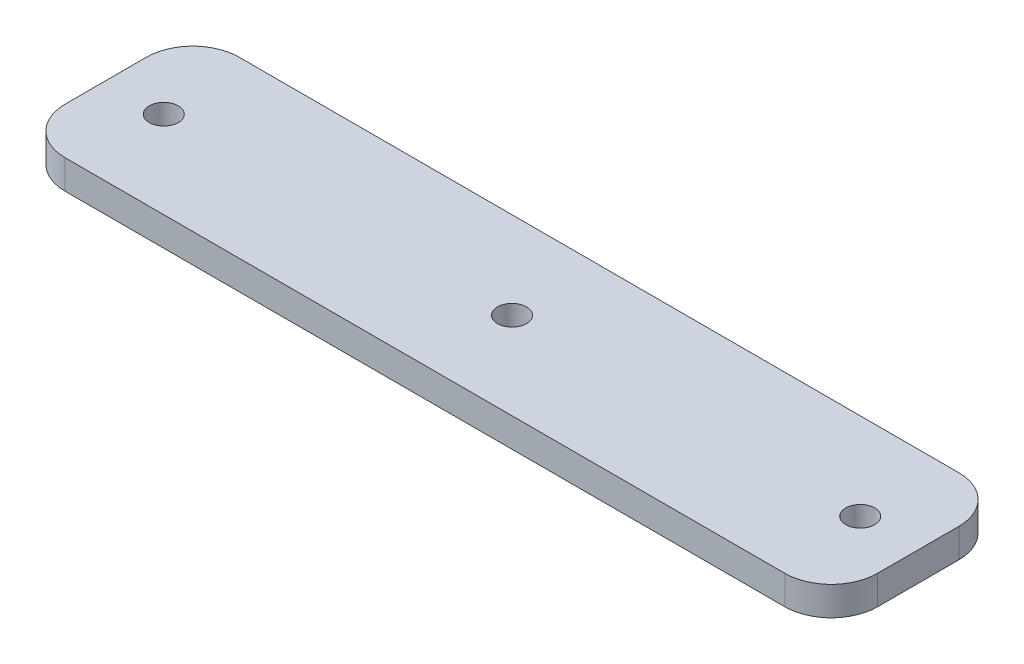
from build123d import *

# Parameters (mm, degrees)
SKETCH1_R           = 3.175
BOSS_EXTRUDE1_DEPTH = 6.35


with BuildPart() as part:
    # Sketch1 → Boss-Extrude1 (new body)
    with BuildSketch(Plane(origin=(0, 0, 0), x_dir=(1, 0, 0), z_dir=(0, 1, 0))):
        with BuildLine():
            Line((10.16, 0), (167.64, 0))
            ThreePointArc((167.64, 0), (174.824204897, -2.975795103), (177.8, -10.16))
            Line((177.8, -10.16), (177.8, -27.94))
            ThreePointArc((177.8, -27.94), (174.824204897, -35.124204897), (167.64, -38.1))
            Line((167.64, -38.1), (10.16, -38.1))
            ThreePointArc((10.16, -38.1), (2.975795103, -35.124204897), (0, -27.94))
            Line((0, -27.94), (0, -10.16))
            ThreePointArc((0, -10.16), (2.975795103, -2.975795103), (10.16, 0))
        make_face()
        with Locations(Location((12.7, -19.05, 0), (0, 0, 270))):
            Circle(SKETCH1_R, mode=Mode.SUBTRACT)
        with Locations(Location((88.9, -19.05, 0), (0, 0, 270))):
            Circle(SKETCH1_R, mode=Mode.SUBTRACT)
        with Locations(Location((165.1, -19.05, 0), (0, 0, 270))):
            Circle(SKETCH1_R, mode=Mode.SUBTRACT)
    extrude(amount=BOSS_EXTRUDE1_DEPTH)


solid = part.part
